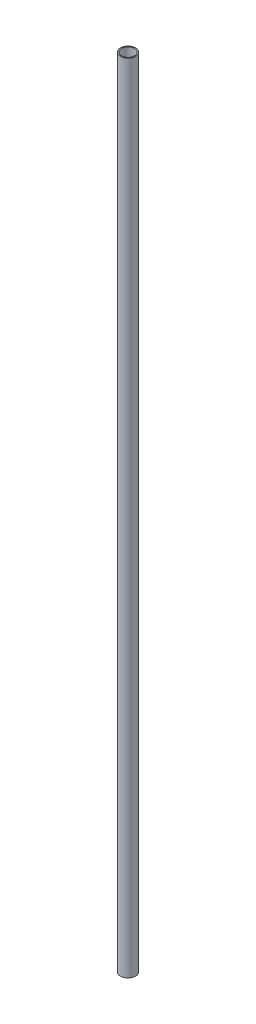
from build123d import *

# Parameters (mm, degrees)
SKETCH2_R           = 15
SKETCH2_R_2         = 13
BOSS_EXTRUDE1_DEPTH = 1600


with BuildPart() as part:
    # Sketch2 → Boss-Extrude1 (new body)
    with BuildSketch(Plane(origin=(0, 0, 0), x_dir=(1, 0, 0), z_dir=(0, 1, 0))):
        with Locations(Location((0, 0, 0), (0, 0, 270))):
            Circle(SKETCH2_R)
        with Locations(Location((0, 0, 0), (0, 0, 270))):
            Circle(SKETCH2_R_2, mode=Mode.SUBTRACT)
    extrude(amount=BOSS_EXTRUDE1_DEPTH)


solid = part.part
